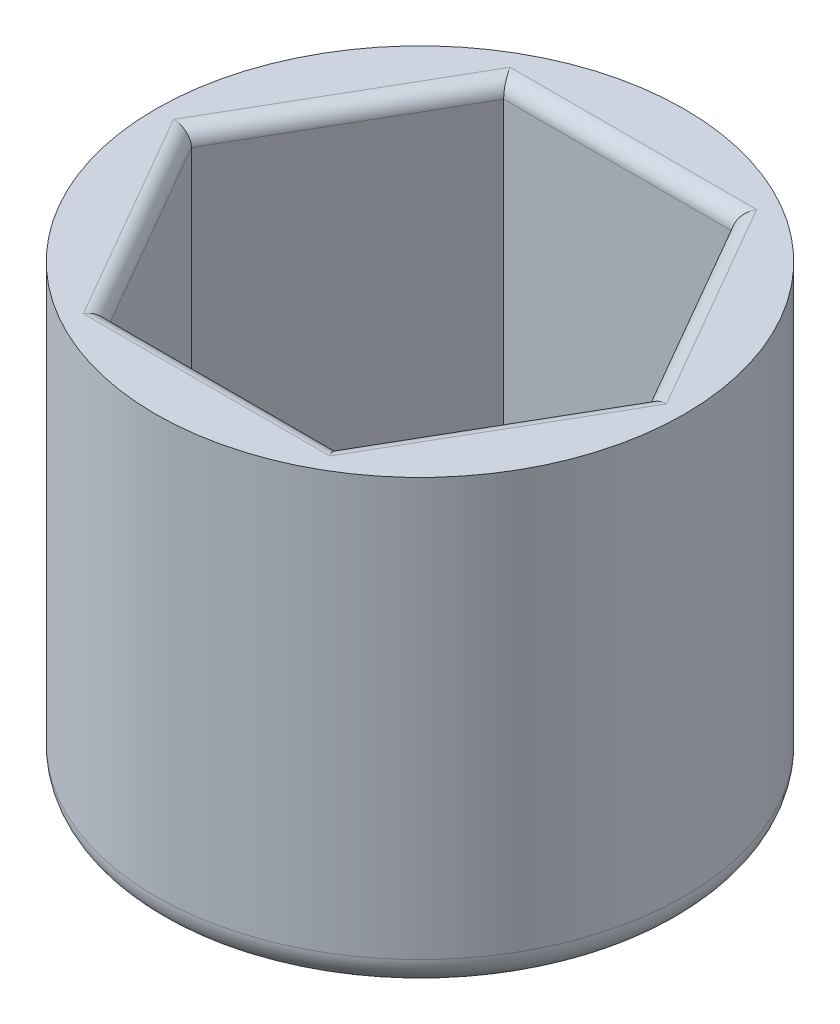
from build123d import *

# Parameters (mm, degrees)
SALIENTE_EXTRUIR1_DEPTH = 12
SALIENTE_EXTRUIR2_DEPTH = 2.5
REDONDEO2_R             = 0.5
SALIENTE_EXTRUIR4_DEPTH = 14.5
REDONDEO5_R             = 1


with BuildPart() as part:
    # Croquis1 → Saliente-Extruir1 (new body)
    with BuildSketch(Plane(origin=(0, 0, 0), x_dir=(1, 0, 0), z_dir=(0, 1, 0))):
        Polygon((8.544783984006465, -6.5e-16), (4.272391992003232, 7.400000000000002), (-4.27239199200323, 7.400000000000003), (-8.544783984006463, 1.3e-15), (-4.272391992003225, -7.400000000000005), (4.272391992003232, -7.400000000000004), align=None)
        Polygon((-3.6950417228136043, 6.400000000000002), (-7.390083445627212, 8.7e-16), (-3.6950417228136003, -6.400000000000005), (3.695041722813607, -6.400000000000004), (7.390083445627214, -1.74e-15), (3.695041722813606, 6.400000000000002), align=None, mode=Mode.SUBTRACT)
    extrude(amount=SALIENTE_EXTRUIR1_DEPTH)

    # Croquis2 → Saliente-Extruir2 (add)
    with BuildSketch(Plane.XZ):
        Polygon((8.544783984006465, 6.5e-16), (4.272391992003232, 7.400000000000004), (-4.272391992003225, 7.400000000000005), (-8.544783984006463, -1.3e-15), (-4.27239199200323, -7.400000000000003), (4.272391992003232, -7.400000000000002), align=None)
    extrude(amount=SALIENTE_EXTRUIR2_DEPTH)

    # Redondeo2
    redondeo2_edges = [part.edges().sort_by_distance(p)[0] for p in [
        (8.9e-16, 12, -6.400000000000002),
        (-5.542562584220408, 12, -3.2000000000000015),
        (-5.5425625842204065, 12, 3.200000000000002),
        (3.11e-15, 12, 6.400000000000005),
        (5.542562584220411, 12, 3.200000000000003),
        (5.54256258422041, 12, -3.2),
    ]]
    fillet(redondeo2_edges, radius=REDONDEO2_R)

    # Croquis3 → Saliente-Extruir4 (add)
    with BuildSketch(Plane.XZ.offset(2.5)):
        with BuildLine():
            Line((4.272391992003232, 7.400000000000004), (8.544783984006465, 6.5e-16))
            ThreePointArc((8.544783984006463, 0), (7.400000000000001, 4.272391992003231), (4.2723919920032305, 7.400000000000002))
        make_face()
        with BuildLine():
            ThreePointArc((4.2723919920032305, 7.400000000000002), (2.42e-15, 8.544783984006463), (-4.272391992003226, 7.400000000000004))
            Line((-4.272391992003225, 7.400000000000005), (4.272391992003232, 7.400000000000004))
        make_face()
        with BuildLine():
            ThreePointArc((-4.272391992003226, 7.400000000000004), (-7.3999999999999995, 4.272391992003234), (-8.544783984006463, 1.05e-15))
            Line((-8.544783984006463, -8.9e-16), (-4.272391992003225, 7.400000000000005))
        make_face()
        with BuildLine():
            ThreePointArc((-8.544783984006463, 1.05e-15), (-7.400000000000001, -4.272391992003232), (-4.272391992003228, -7.400000000000003))
            Line((-4.27239199200323, -7.400000000000003), (-8.544783984006463, -1.3e-15))
        make_face()
        with BuildLine():
            Line((4.272391992003231, -7.400000000000002), (-4.27239199200323, -7.400000000000003))
            ThreePointArc((-4.272391992003228, -7.400000000000003), (-1.57e-15, -8.544783984006463), (4.272391992003226, -7.400000000000005))
        make_face()
        with BuildLine():
            Line((8.544783984006465, 8.9e-16), (4.272391992003232, -7.400000000000002))
            ThreePointArc((4.272391992003226, -7.400000000000005), (7.399999999999999, -4.272391992003235), (8.544783984006463, -2.09e-15))
        make_face()
    extrude(amount=-SALIENTE_EXTRUIR4_DEPTH)

    # Redondeo5
    redondeo5_edges = [part.edges().sort_by_distance(p)[0] for p in [
        (8.544783984006457, -2.5, -2.9e-16),
    ]]
    fillet(redondeo5_edges, radius=REDONDEO5_R)


solid = part.part
